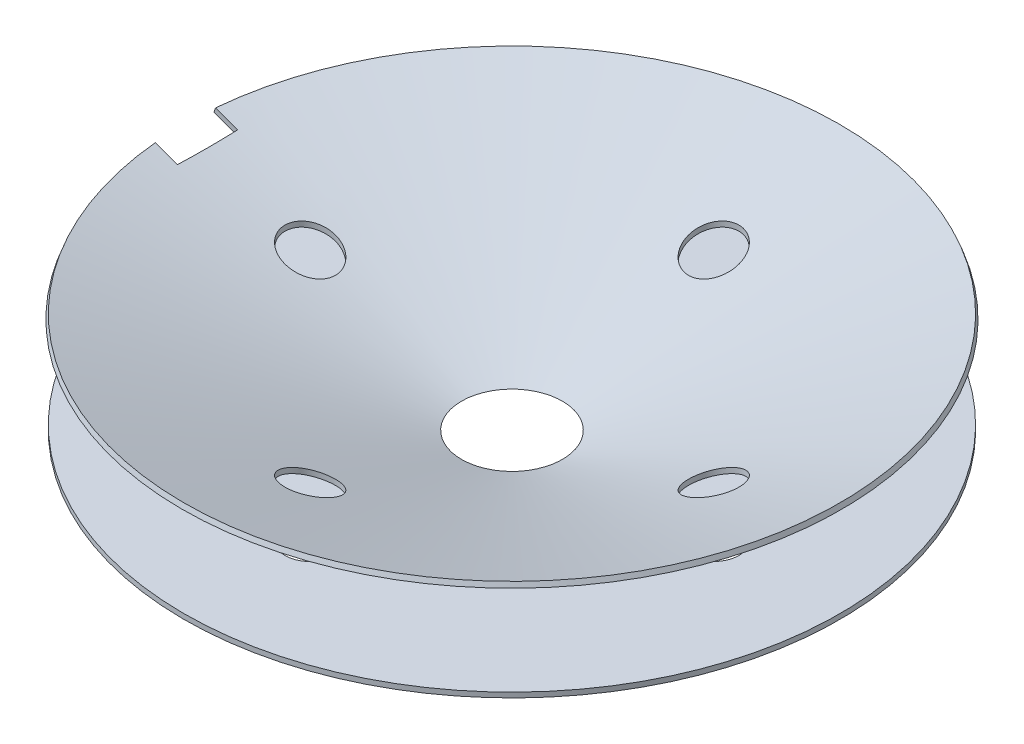
from build123d import *

# Parameters (mm, degrees)
SKETCH2_R          = 5
SKETCH2_W          = 10
SKETCH2_H          = 11.93656
CUT_EXTRUDE1_DEPTH = 95.551012926


with BuildPart() as part:
    # Sketch1 → Revolve-Thin1 (revolve)
    with BuildSketch(Plane.XY):
        Polygon((-65, 0), (-10, -20.018362885), (-65, -20.018362885), (-65, -19.018362885), (-15.67128182, -19.018362885), (-65.342020143, -0.939692621), align=None)
    revolve(axis=Axis((0, 0, 0), (0, -1, 0)))

    # Sketch2 → Cut-Extrude1 (cut, through all)
    with BuildSketch(Plane(origin=(0, 0, 0), x_dir=(1, 0, 0), z_dir=(0, 1, 0))):
        with Locations(Location((-40, 0, 0), (0, 0, 270))):
            Circle(SKETCH2_R)
        with Locations(Location((0, 40, 0), (0, 0, 270))):
            Circle(SKETCH2_R)
        with Locations(Location((40, 0, 0), (0, 0, 270))):
            Circle(SKETCH2_R)
        with Locations(Location((0, -40, 0), (0, 0, 270))):
            Circle(SKETCH2_R)
        with Locations((-65.342020143, 0)):
            Rectangle(SKETCH2_W, SKETCH2_H)
    extrude(amount=-CUT_EXTRUDE1_DEPTH, mode=Mode.SUBTRACT)


solid = part.part
